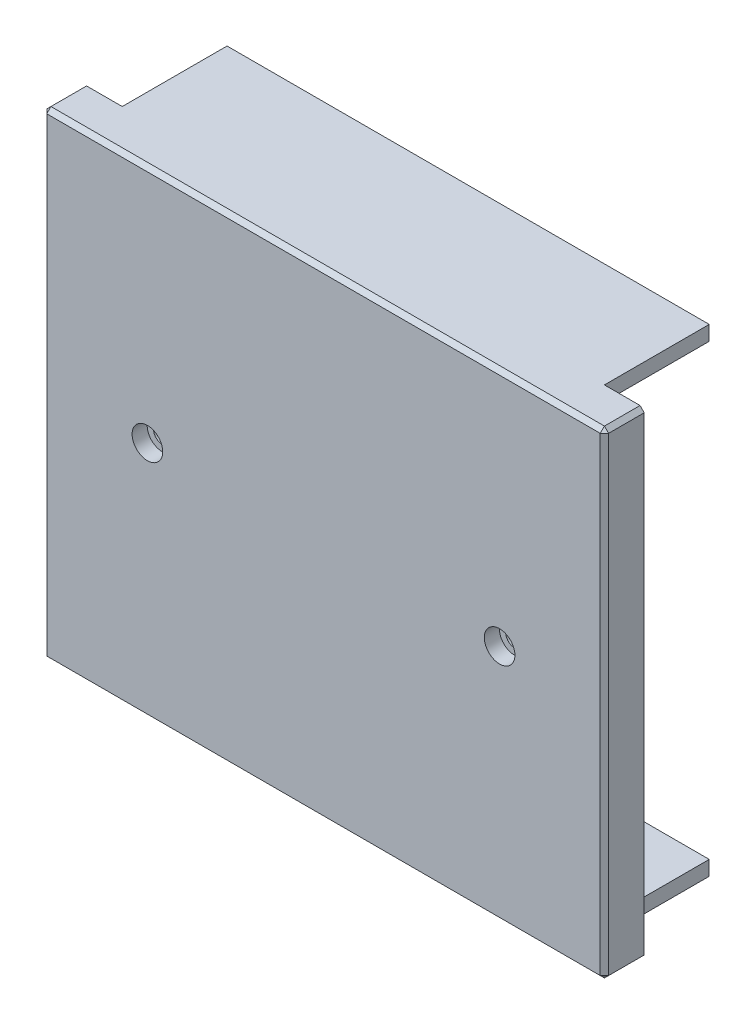
from build123d import *

# Parameters (mm, degrees)
SKETCH1_W           = 134
SKETCH1_H           = 114
BOSS_EXTRUDE1_DEPTH = 9.5
SKETCH2_W           = 115
SKETCH2_H           = 3.5
BOSS_EXTRUDE2_DEPTH = 25
SKETCH3_R           = 2.15
CUT_EXTRUDE1_DEPTH  = 180.282598152
SKETCH4_R           = 3.65
CUT_EXTRUDE2_DEPTH  = 3.6
CHAMFER1_SIZE       = 1


with BuildPart() as part:
    # Sketch1 → Boss-Extrude1 (new body)
    with BuildSketch(Plane.XY):
        with Locations((67, 57)):
            Rectangle(SKETCH1_W, SKETCH1_H)
    extrude(amount=BOSS_EXTRUDE1_DEPTH)

    # Sketch2 → Boss-Extrude2 (add)
    with BuildSketch(Plane(origin=(0, 0, 0), x_dir=(-1, 0, 0), z_dir=(0, 0, -1))):
        Polygon((-67, 114), (-124.5, 114), (-124.5, 110.5), (-9.5, 110.5), (-9.5, 114), align=None)
        with Locations((-67, 1.75)):
            Rectangle(SKETCH2_W, SKETCH2_H)
    extrude(amount=BOSS_EXTRUDE2_DEPTH)

    # Sketch3 → Cut-Extrude1 (cut, through all)
    with BuildSketch(Plane.XY.offset(9.5)):
        with Locations((25, 57)):
            Circle(SKETCH3_R)
        with Locations((109, 57)):
            Circle(SKETCH3_R)
    extrude(amount=-CUT_EXTRUDE1_DEPTH, mode=Mode.SUBTRACT)

    # Sketch4 → Cut-Extrude2 (cut)
    with BuildSketch(Plane.XY.offset(9.5)):
        with Locations((25, 57)):
            Circle(SKETCH4_R)
        with Locations((109, 57)):
            Circle(SKETCH4_R)
    extrude(amount=-CUT_EXTRUDE2_DEPTH, mode=Mode.SUBTRACT)

    # Chamfer1
    chamfer1_edges = [part.edges().sort_by_distance(p)[0] for p in [
        (134, 57, 9.5),
        (67, 114, 9.5),
        (0, 57, 9.5),
        (67, 0, 9.5),
        (0, 114, 4.75),
        (134, 114, 4.75),
        (134, 0, 4.75),
        (0, 0, 4.75),
    ]]
    chamfer(chamfer1_edges, length=CHAMFER1_SIZE)


solid = part.part
